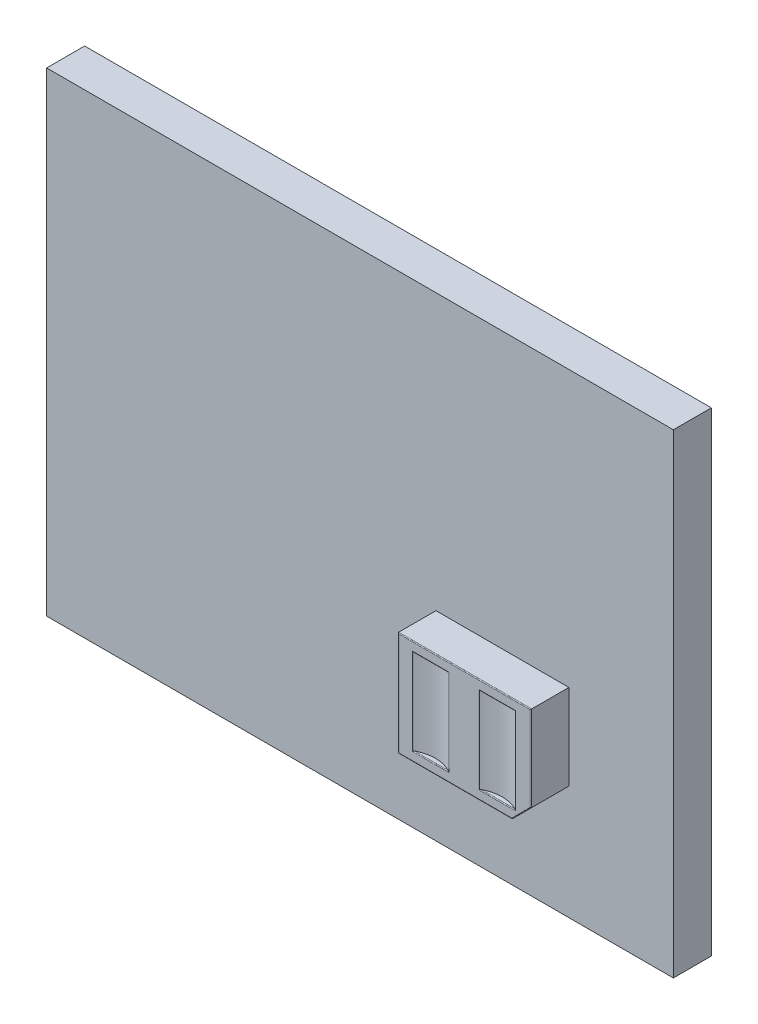
from build123d import *

# Parameters (mm, degrees)
ESQUISSE1_W             = 16.5
ESQUISSE1_H             = 12.5
EXTRUSION1_DEPTH        = 1
EXTRUSION2_DEPTH        = 2
ENL_V_MAT_EXTRU_1_DEPTH = 2.25
CONG_1_R                = 0.02


with BuildPart() as part:
    # Esquisse1 → Extrusion1 (new body)
    with BuildSketch(Plane.XY):
        Rectangle(ESQUISSE1_W, ESQUISSE1_H)
    extrude(amount=EXTRUSION1_DEPTH)

    # Esquisse3 → Extrusion2 (add)
    with BuildSketch(Plane.XY):
        Polygon((2, -1), (5.5, -1), (5.5, -3.25), (5, -3.75), (2, -3.75), align=None)
    extrude(amount=EXTRUSION2_DEPTH)

    # Esquisse4 → Enlèv. mat.-Extru.1 (cut)
    with BuildSketch(Plane.XZ.offset(3.5)):
        with BuildLine():
            Line((2.384572819, 2), (3.334776238, 2))
            ThreePointArc((3.334776238, 2), (2.859674528, 1.872882694), (2.384572819, 2))
        make_face()
        with BuildLine():
            Line((5.09220572, 2), (4.142002301, 2))
            ThreePointArc((4.142002301, 2), (4.61710401, 1.872882694), (5.09220572, 2))
        make_face()
    extrude(amount=-ENL_V_MAT_EXTRU_1_DEPTH, mode=Mode.SUBTRACT)

    # Congé1
    cong_1_edges = [part.edges().sort_by_distance(p)[0] for p in [
        (3.75, -1, 2),
        (5.5, -2.125, 2),
        (5.25, -3.5, 2),
        (3.5, -3.75, 2),
        (2, -2.375, 2),
        (4.61710401, -3.5, 2),
        (4.142002301, -2.375, 2),
        (4.61710401, -1.25, 2),
        (5.09220572, -2.375, 2),
        (2.384572819, -2.375, 2),
        (2.859674528, -1.25, 2),
        (3.334776238, -2.375, 2),
        (2.859674528, -3.5, 2),
    ]]
    fillet(cong_1_edges, radius=CONG_1_R)


solid = part.part
